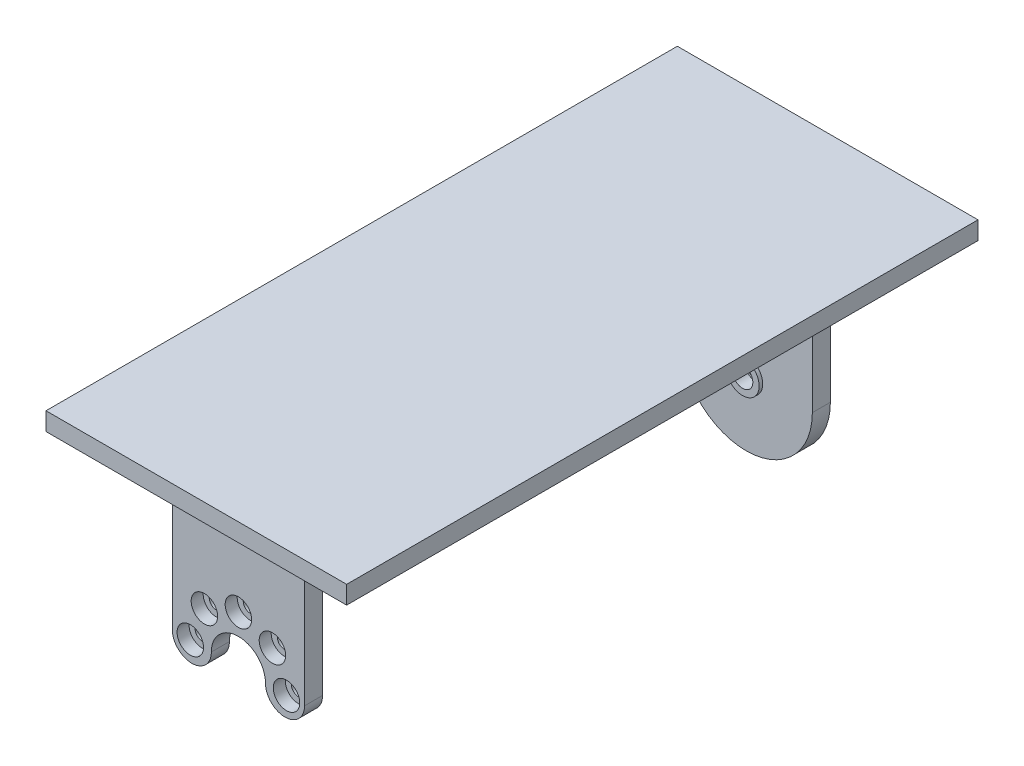
from build123d import *

# Parameters (mm, degrees)
RESSALTO_EXTRUS_O1_DEPTH                            = 3
ESBO_O2_W                                           = 50
ESBO_O2_H                                           = 105
RESSALTO_EXTRUS_O2_DEPTH                            = 3
RESSALTO_EXTRUS_O3_DEPTH                            = 3
REBAIXO_PARA_SHCS_M21_D                             = 2.4
REBAIXO_PARA_SHCS_M21_DEPTH                         = 3
REBAIXO_PARA_SHCS_M21_CBORE_D                       = 4.4
REBAIXO_PARA_SHCS_M21_CBORE_DEPTH                   = 2
PADR_OCIRCULAR1_COUNT                               = 5
PADR_OCIRCULAR1_ANGLE                               = 180
NERVURA1_REACH                                      = 104.147
ESBO_O6_WALL_W                                      = 216.193400866
ESBO_O6_WALL_H                                      = 15
CORTE_EXTRUS_O1_REACH                               = 106.943
ESBO_O7_W                                           = 10
ESBO_O7_H                                           = 7
NERVURA7_REACH                                      = 104.147
ESBO_O8_WALL_W                                      = 216.193400866
ESBO_O8_WALL_H                                      = 15
CORTE_EXTRUS_O2_REACH                               = 104.147
ESBO_O9_W                                           = 10
ESBO_O9_H                                           = 7
PADR_O_LINEAR1_COUNT                                = 2
PADR_O_LINEAR1_PITCH                                = 84.45
ESBO_O10_R                                          = 2.75
RESSALTO_EXTRUS_O4_DEPTH                            = 0.6
REBAIXO_PARA_PARAFUSO_COM_CABE_A_PANELA_D           = 3.4
REBAIXO_PARA_PARAFUSO_COM_CABE_A_PANELA_CBORE_D     = 7
REBAIXO_PARA_PARAFUSO_COM_CABE_A_PANELA_CBORE_DEPTH = 1.5
FILETE1_R                                           = 5


with BuildPart() as part:
    # Esboço1 → Ressalto-extrusão1 (new body)
    with BuildSketch(Plane.XY):
        with BuildLine():
            Line((11, 0), (11, 25))
            Line((11, 25), (-11, 25))
            Line((-11, 25), (-11, 0))
            ThreePointArc((-11, 0), (-7.75, -3.25), (-4.5, 0))
            ThreePointArc((-4.5, 0), (0, 4.5), (4.5, 0))
            ThreePointArc((4.5, 0), (7.75, -3.25), (11, 0))
        make_face()
    extrude(amount=RESSALTO_EXTRUS_O1_DEPTH)

    # Esboço2 → Ressalto-extrusão2 (add)
    with BuildSketch(Plane(origin=(0, 25, 0), x_dir=(1, 0, 0), z_dir=(0, 1, 0))):
        with Locations((0, 42.5)):
            Rectangle(ESBO_O2_W, ESBO_O2_H)
    extrude(amount=RESSALTO_EXTRUS_O2_DEPTH)

    # Esboço3 → Ressalto-extrusão3 (add)
    with BuildSketch(Plane(origin=(0, 0, -81.45), x_dir=(-1, 0, 0), z_dir=(0, 0, -1))):
        with BuildLine():
            Line((-11, 0), (-11, 25))
            Line((-11, 25), (11, 25))
            Line((11, 25), (11, 0))
            ThreePointArc((11, 0), (0, -11), (-11, 0))
        make_face()
    extrude(amount=RESSALTO_EXTRUS_O3_DEPTH)

    # Rebaixo para SHCS M21
    with Locations(Plane.XY.offset(3)):
        with Locations((8, 0)):
            rebaixo_para_shcs_m21 = CounterBoreHole(REBAIXO_PARA_SHCS_M21_D / 2, REBAIXO_PARA_SHCS_M21_CBORE_D / 2, REBAIXO_PARA_SHCS_M21_CBORE_DEPTH, depth=REBAIXO_PARA_SHCS_M21_DEPTH)

    # PadrãoCircular1: Rebaixo para SHCS M21 ×5 about axis
    padr_ocircular1_axis = Axis((0, 0, 0), (0, 0, 1))
    for i in range(1, PADR_OCIRCULAR1_COUNT):
        add(rebaixo_para_shcs_m21.rotate(padr_ocircular1_axis, i * PADR_OCIRCULAR1_ANGLE / (PADR_OCIRCULAR1_COUNT - 1)), mode=Mode.SUBTRACT)

    # Esboço6 wall → Nervura1 (add, up to next)
    with BuildSketch(Plane(origin=(0, 21.5, 6.5), x_dir=(0, 0.707106781187, 0.707106781187), z_dir=(0, -0.707106781187, 0.707106781187)), mode=Mode.PRIVATE) as nervura1_sk1:
        Rectangle(ESBO_O6_WALL_W, ESBO_O6_WALL_H)
    nervura1_tool1 = extrude(nervura1_sk1.sketch, amount=-NERVURA1_REACH, mode=Mode.PRIVATE) - part.part
    nervura1 = nervura1_tool1.solids().sort_by_distance((0, 21.5, 6.5))[0]
    add(nervura1)

    # Corte-extrusão1: up to this face of the body (flat: up to its plane)
    corte_extrus_o1_end = Plane(part.part.faces().sort_by_distance((0, 21.5, 6.5))[0])
    # Esboço7 → Corte-extrusão1 (cut, up to the picked face)
    with BuildSketch(Plane.XY.offset(3), mode=Mode.PRIVATE) as corte_extrus_o1_sk1:
        with Locations((0, 21.5)):
            Rectangle(ESBO_O7_W, ESBO_O7_H)
    corte_extrus_o1_tool1 = split(extrude(corte_extrus_o1_sk1.sketch, amount=CORTE_EXTRUS_O1_REACH, mode=Mode.PRIVATE), bisect_by=corte_extrus_o1_end, keep=Keep.BOTH, mode=Mode.PRIVATE)
    corte_extrus_o1 = corte_extrus_o1_tool1.solids().sort_by(Axis((0, 21.5, 3), (0, 0, 1)))[0]
    add(corte_extrus_o1, mode=Mode.SUBTRACT)

    # Esboço8 wall → Nervura7 (add, up to next)
    with BuildSketch(Plane(origin=(0, 21.5, -3.5), x_dir=(0, 0.707106781187, -0.707106781187), z_dir=(0, 0.707106781187, 0.707106781187)), mode=Mode.PRIVATE) as nervura7_sk1:
        Rectangle(ESBO_O8_WALL_W, ESBO_O8_WALL_H)
    nervura7_tool1 = extrude(nervura7_sk1.sketch, amount=NERVURA7_REACH, mode=Mode.PRIVATE) - part.part
    nervura7 = nervura7_tool1.solids().sort_by_distance((0, 21.5, -3.5))[0]
    add(nervura7)

    # Corte-extrusão2: up to this face of the body (flat: up to its plane)
    corte_extrus_o2_end = Plane(part.part.faces().sort_by_distance((0, 21.5, -3.5))[0])
    # Esboço9 → Corte-extrusão2 (cut, up to the picked face)
    with BuildSketch(Plane(origin=(0, 0, 0), x_dir=(-1, 0, 0), z_dir=(0, 0, -1)), mode=Mode.PRIVATE) as corte_extrus_o2_sk1:
        with Locations((0, 21.5)):
            Rectangle(ESBO_O9_W, ESBO_O9_H)
    corte_extrus_o2_tool1 = split(extrude(corte_extrus_o2_sk1.sketch, amount=CORTE_EXTRUS_O2_REACH, mode=Mode.PRIVATE), bisect_by=corte_extrus_o2_end, keep=Keep.BOTH, mode=Mode.PRIVATE)
    corte_extrus_o2 = corte_extrus_o2_tool1.solids().sort_by(Axis((0, 21.5, 0), (0, 0, -1)))[0]
    add(corte_extrus_o2, mode=Mode.SUBTRACT)

    # Padrão linear1: Nervura1, Corte-extrusão1, Nervura7, Corte-extrusão2 ×2
    with Locations(*[(0, 0, -i * PADR_O_LINEAR1_PITCH) for i in range(1, PADR_O_LINEAR1_COUNT)]):
        add(nervura1)
        add(corte_extrus_o1, mode=Mode.SUBTRACT)
        add(nervura7)
        add(corte_extrus_o2, mode=Mode.SUBTRACT)

    # Esboço10 → Ressalto-extrusão4 (add)
    with BuildSketch(Plane.XY.offset(-81.45)):
        with Locations(Location((0, 0, 0), (0, 0, 180))):
            Circle(ESBO_O10_R)
    extrude(amount=RESSALTO_EXTRUS_O4_DEPTH)

    # Rebaixo para parafuso com cabeça panela de M31 (through all)
    with Locations(Plane(origin=(0, 0, -84.45), x_dir=(-1, 0, 0), z_dir=(0, 0, -1))):
        with Locations((0, 0)):
            CounterBoreHole(REBAIXO_PARA_PARAFUSO_COM_CABE_A_PANELA_D / 2, REBAIXO_PARA_PARAFUSO_COM_CABE_A_PANELA_CBORE_D / 2, REBAIXO_PARA_PARAFUSO_COM_CABE_A_PANELA_CBORE_DEPTH)

    # Filete1
    filete1_edges = [part.edges().sort_by_distance(p)[0] for p in [
        (-11, 25, 1.5),
        (11, 25, 1.5),
        (0, 25, 3),
        (9.25, 25, 3),
        (-9.25, 25, 0),
        (0, 25, 0),
        (9.25, 25, -81.45),
        (0, 25, -81.45),
        (9.25, 25, -84.45),
        (0, 25, -84.45),
        (-9.25, 25, -81.45),
        (-11, 25, -82.95),
        (11, 25, -82.95),
        (-9.25, 25, -84.45),
        (9.25, 25, 0),
        (-9.25, 25, 3),
    ]]
    fillet(filete1_edges, radius=FILETE1_R)


solid = part.part
